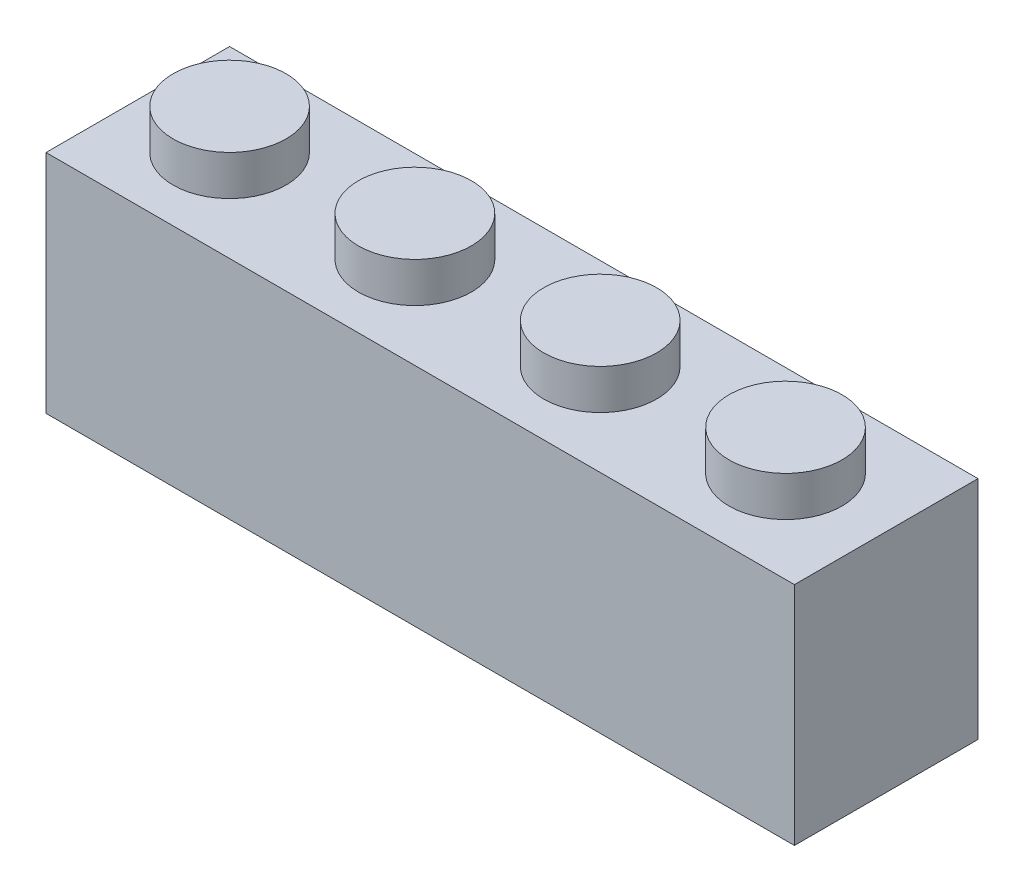
from build123d import *

# Parameters (mm, degrees)
SKETCH_1_W          = 31.8
SKETCH_1_H          = 7.8
EXTRUDE_1_DEPTH     = 9.6
SKETCH_2_R          = 2.4
EXTRUDE_2_DEPTH     = 1.7
SKETCH_3_R          = 2.5
CUT_EXTRUDE_1_DEPTH = 1.8


with BuildPart() as part:
    # Эскиз1 → Бобышка-Вытянуть1 (new body)
    with BuildSketch(Plane(origin=(0, 0, 0), x_dir=(1, 0, 0), z_dir=(0, 1, 0))):
        Rectangle(SKETCH_1_W, SKETCH_1_H)
    extrude(amount=EXTRUDE_1_DEPTH)

    # Эскиз2 → Бобышка-Вытянуть2 (add)
    with BuildSketch(Plane(origin=(0, 9.6, 0), x_dir=(1, 0, 0), z_dir=(0, 1, 0))):
        with Locations(Location((-12, 0, 0), (0, 0, 270))):
            Circle(SKETCH_2_R)
        with Locations(Location((-4.126, 0, 0), (0, 0, 270))):
            Circle(SKETCH_2_R)
        with Locations(Location((3.748, 0, 0), (0, 0, 270))):
            Circle(SKETCH_2_R)
        with Locations(Location((11.622, 0, 0), (0, 0, 270))):
            Circle(SKETCH_2_R)
    extrude(amount=EXTRUDE_2_DEPTH)

    # Эскиз3 → Вырез-Вытянуть1 (cut)
    with BuildSketch(Plane.XZ):
        with Locations(Location((-12, 0, 0), (0, 0, 270))):
            Circle(SKETCH_3_R)
        with Locations(Location((-4.126, 0, 0), (0, 0, 270))):
            Circle(SKETCH_3_R)
        with Locations(Location((3.748, 0, 0), (0, 0, 270))):
            Circle(SKETCH_3_R)
        with Locations(Location((11.622, 0, 0), (0, 0, 270))):
            Circle(SKETCH_3_R)
    extrude(amount=-CUT_EXTRUDE_1_DEPTH, mode=Mode.SUBTRACT)


solid = part.part
